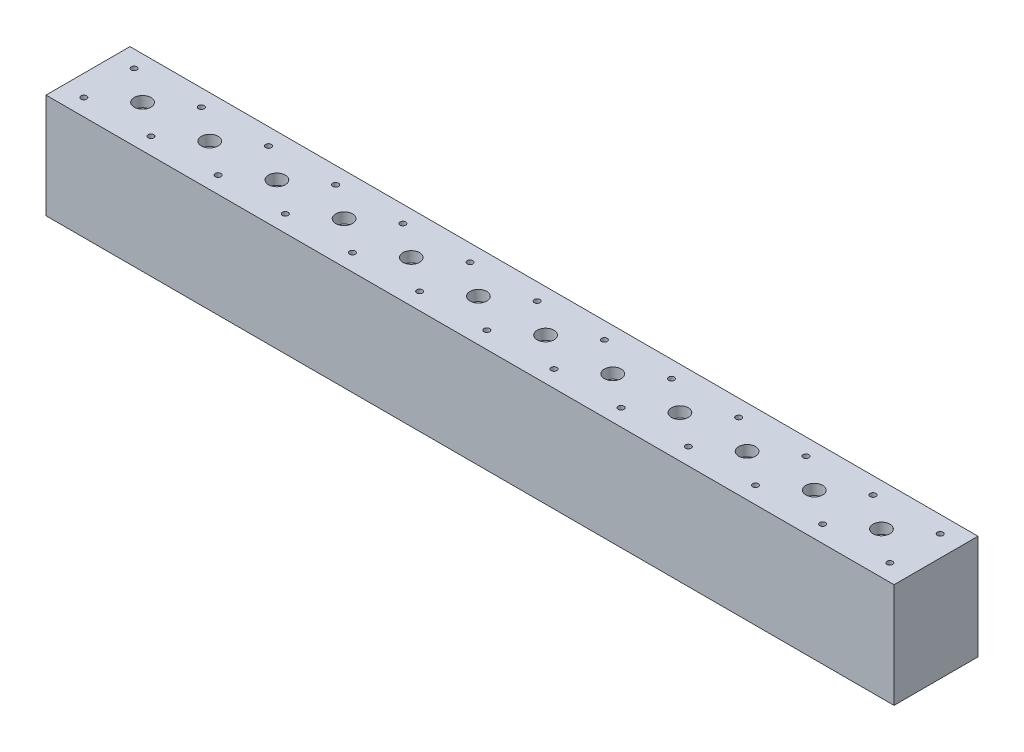
from build123d import *

# Parameters (mm, degrees)
SKETCH1_W                                            = 100
SKETCH1_H                                            = 124.5
BOSS_EXTRUDE1_DEPTH                                  = 505
M8_TAPPED_HOLE1_D                                    = 6.8
M8_TAPPED_HOLE1_DEPTH                                = 22.25
M8_TAPPED_HOLE1_TIP                                  = 2.042926105
CBORE_FOR_M12_HEX_SOCKET_HEAD_CAP_SCREW1_D           = 13
CBORE_FOR_M12_HEX_SOCKET_HEAD_CAP_SCREW1_CBORE_D     = 20
CBORE_FOR_M12_HEX_SOCKET_HEAD_CAP_SCREW1_CBORE_DEPTH = 12.6
LPATTERN1_COUNT                                      = 12
LPATTERN1_PITCH                                      = 80


with BuildPart() as part:
    # Sketch1 → Boss-Extrude1 (new, symmetric)
    with BuildSketch(Plane(origin=(0, 0, 0), x_dir=(0, 0, -1), z_dir=(1, 0, 0))):
        Rectangle(SKETCH1_W, SKETCH1_H)
    extrude(amount=BOSS_EXTRUDE1_DEPTH, both=True)

    # M8 Tapped Hole1
    with Locations(Plane(origin=(0, 62.25, 0), x_dir=(1, 0, 0), z_dir=(0, 1, 0))):
        with Locations((480, 30), (480, -30), (400, 30), (400, -30), (320, 30), (320, -30), (240, -30), (240, 30), (160, 30), (160, -30), (80, 30), (80, -30), (0, -30), (0, 30), (-80, -30), (-80, 30), (-160, -30), (-160, 30), (-240, -30), (-240, 30), (-320, -30), (-320, 30), (-400, -30), (-400, 30), (-480, 30), (-480, -30)):
            Hole(M8_TAPPED_HOLE1_D / 2, depth=M8_TAPPED_HOLE1_DEPTH)
            with Locations((0, 0, -(M8_TAPPED_HOLE1_DEPTH + M8_TAPPED_HOLE1_TIP / 2))):  # 118° drill point
                Cone(0, M8_TAPPED_HOLE1_D / 2, M8_TAPPED_HOLE1_TIP, mode=Mode.SUBTRACT)

    # CBORE for M12 Hex Socket Head Cap Screw1 (through all)
    with Locations(Plane(origin=(0, 62.25, 0), x_dir=(1, 0, 0), z_dir=(0, 1, 0))):
        with Locations((440, 0)):
            cbore_for_m12_hex_socket_head_cap_screw1 = CounterBoreHole(CBORE_FOR_M12_HEX_SOCKET_HEAD_CAP_SCREW1_D / 2, CBORE_FOR_M12_HEX_SOCKET_HEAD_CAP_SCREW1_CBORE_D / 2, CBORE_FOR_M12_HEX_SOCKET_HEAD_CAP_SCREW1_CBORE_DEPTH)

    # LPattern1: CBORE for M12 Hex Socket Head Cap Screw1 ×12
    with Locations(*[(-i * LPATTERN1_PITCH, 0, 0) for i in range(1, LPATTERN1_COUNT)]):
        add(cbore_for_m12_hex_socket_head_cap_screw1, mode=Mode.SUBTRACT)


solid = part.part
